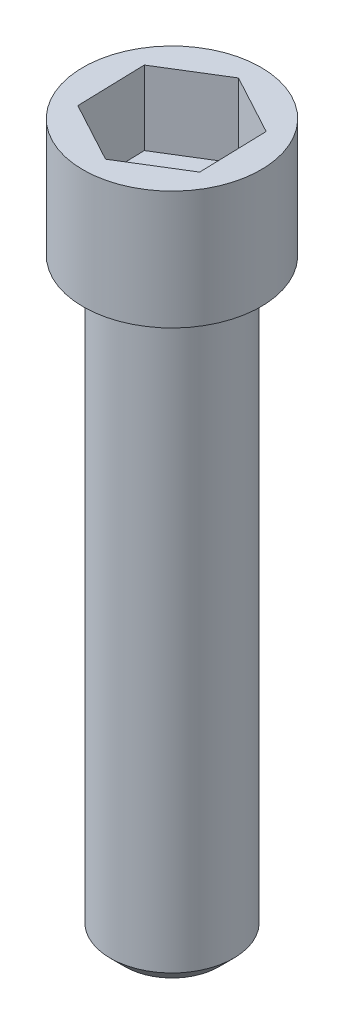
from build123d import *

# Parameters (mm, degrees)
SKETCH1_R           = 1.04
BOSS_EXTRUDE1_DEPTH = 10
SKETCH2_R           = 1.5
BOSS_EXTRUDE2_DEPTH = 2
CUT_EXTRUDE1_DEPTH  = 1.25
CHAMFER1_SIZE       = 0.25


with BuildPart() as part:
    # Sketch1 → Boss-Extrude1 (new body)
    with BuildSketch(Plane(origin=(0, 0, 0), x_dir=(1, 0, 0), z_dir=(0, 1, 0))):
        with Locations(Location((0, 0, 0), (0, 0, 270))):
            Circle(SKETCH1_R)
    extrude(amount=BOSS_EXTRUDE1_DEPTH)

    # Sketch2 → Boss-Extrude2 (add)
    with BuildSketch(Plane(origin=(0, 10, 0), x_dir=(1, 0, 0), z_dir=(0, 1, 0))):
        with Locations(Location((0, 0, 0), (0, 0, 270))):
            Circle(SKETCH2_R)
    extrude(amount=BOSS_EXTRUDE2_DEPTH)

    # Sketch3 → Cut-Extrude1 (cut)
    with BuildSketch(Plane(origin=(0, 12, 0), x_dir=(1, 0, 0), z_dir=(0, 1, 0))):
        Polygon((-0.032777471, 1.154235232), (-1.015985768, 0.548731493), (-0.983208297, -0.605503739), (0.032777471, -1.154235232), (1.015985768, -0.548731493), (0.983208297, 0.605503739), align=None)
    extrude(amount=-CUT_EXTRUDE1_DEPTH, mode=Mode.SUBTRACT)

    # Chamfer1
    chamfer1_edges = [part.edges().sort_by_distance(p)[0] for p in [
        (0, 0, -1.04),
    ]]
    chamfer(chamfer1_edges, length=CHAMFER1_SIZE)


solid = part.part
